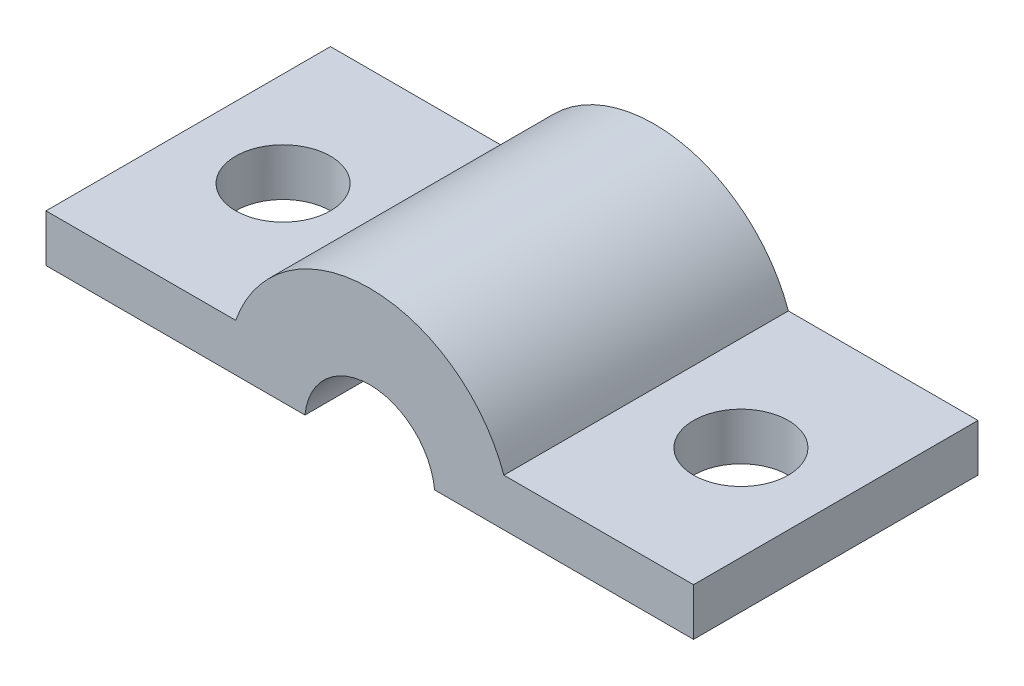
from build123d import *

# Parameters (mm, degrees)
BOSS_EXTRUDE1_DEPTH = 9
SKETCH2_R           = 1.5
CUT_EXTRUDE1_DEPTH  = 10


with BuildPart() as part:
    # Sketch1 → Boss-Extrude1 (new body)
    with BuildSketch(Plane.XY):
        with BuildLine():
            Line((2.05, 0), (10.242640687, 0))
            Line((10.242640687, 0), (10.242640687, 1.5))
            Line((10.242640687, 1.5), (4.242640687, 1.5))
            ThreePointArc((4.242640687, 1.5), (0, 4.5), (-4.242640687, 1.5))
            Line((-4.242640687, 1.5), (-10.242640687, 1.5))
            Line((-10.242640687, 1.5), (-10.242640687, 0))
            Line((-10.242640687, 0), (-2.05, 0))
            ThreePointArc((-2.05, 0), (0, 1.857268651), (2.05, 0))
        make_face()
    extrude(amount=BOSS_EXTRUDE1_DEPTH)

    # Sketch2 → Cut-Extrude1 (cut)
    with BuildSketch(Plane(origin=(0, 1.5, 0), x_dir=(1, 0, 0), z_dir=(0, 1, 0))):
        with Locations(Location((-7.242640687, -4.5, 0), (0, 0, 270))):
            Circle(SKETCH2_R)
        with Locations(Location((7.242640687, -4.5, 0), (0, 0, 270))):
            Circle(SKETCH2_R)
    extrude(amount=-CUT_EXTRUDE1_DEPTH, mode=Mode.SUBTRACT)


solid = part.part
